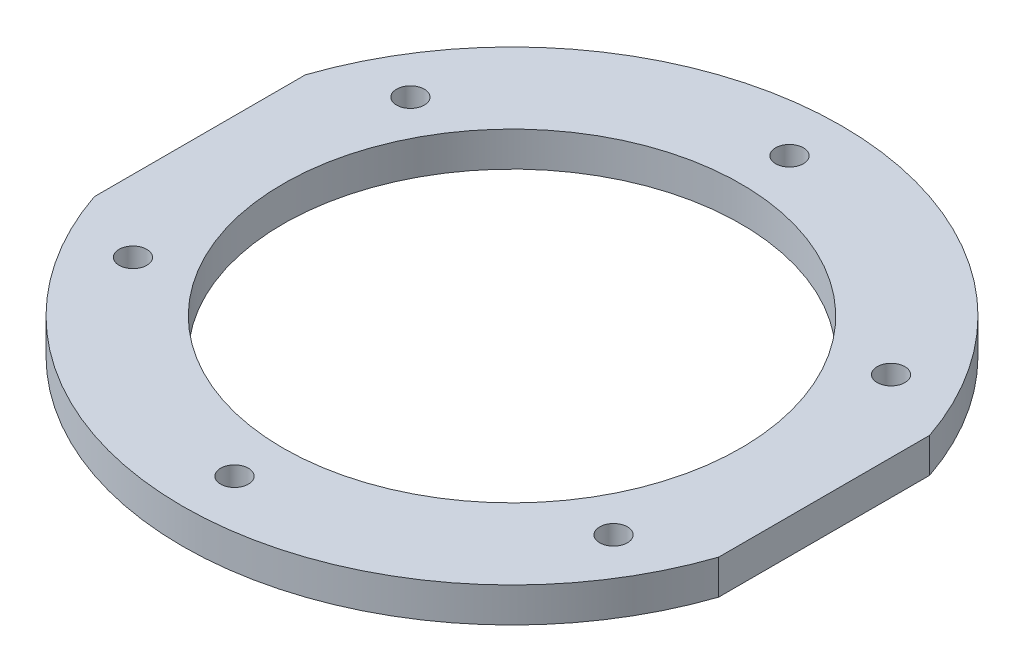
from build123d import *

# Parameters (mm, degrees)
SKETCH_1_R               = 47.5
SKETCH_1_R_2             = 33
EXTRUDE_1_DEPTH          = 5
SKETCH_2_W               = 10
SKETCH_2_H               = 20
CUT_EXTRUDE_1_DEPTH      = 25
SKETCH_3_R               = 2
CUT_EXTRUDE_2_DEPTH      = 25
PATTERN_CIRCULAR_1_COUNT = 3


with BuildPart() as part:
    # Эскиз1 → Бобышка-Вытянуть1 (new body)
    with BuildSketch(Plane(origin=(0, 0, 0), x_dir=(1, 0, 0), z_dir=(0, 1, 0))):
        with Locations(Location((0, 0, 0), (0, 0, 270))):
            Circle(SKETCH_1_R)
        with Locations(Location((0, 0, 0), (0, 0, 270))):
            Circle(SKETCH_1_R_2, mode=Mode.SUBTRACT)
    extrude(amount=EXTRUDE_1_DEPTH)

    # Эскиз2 → Вырез-Вытянуть1 (cut, symmetric)
    with BuildSketch(Plane.XY):
        with Locations((-50, 5)):
            Rectangle(SKETCH_2_W, SKETCH_2_H)
        with Locations((50, 5)):
            Rectangle(SKETCH_2_W, SKETCH_2_H)
    extrude(amount=CUT_EXTRUDE_1_DEPTH, both=True, mode=Mode.SUBTRACT)

    # Эскиз3 → Вырез-Вытянуть2 (cut, symmetric)
    with BuildSketch(Plane(origin=(0, 0, 0), x_dir=(1, 0, 0), z_dir=(0, 1, 0))):
        with Locations(Location((0, 40, 0), (0, 0, 270))):
            Circle(SKETCH_3_R)
        with Locations(Location((0, -40, 0), (0, 0, 270))):
            Circle(SKETCH_3_R)
    cut_extrude_2 = extrude(amount=CUT_EXTRUDE_2_DEPTH, both=True, mode=Mode.SUBTRACT)

    # Круговой массив1: Вырез-Вытянуть2 ×3 about axis
    pattern_circular_1_axis = Axis((0, 0, 0), (0, 1, 0))
    for i in range(1, PATTERN_CIRCULAR_1_COUNT):
        add(cut_extrude_2.rotate(pattern_circular_1_axis, i * 360 / PATTERN_CIRCULAR_1_COUNT), mode=Mode.SUBTRACT)


solid = part.part
